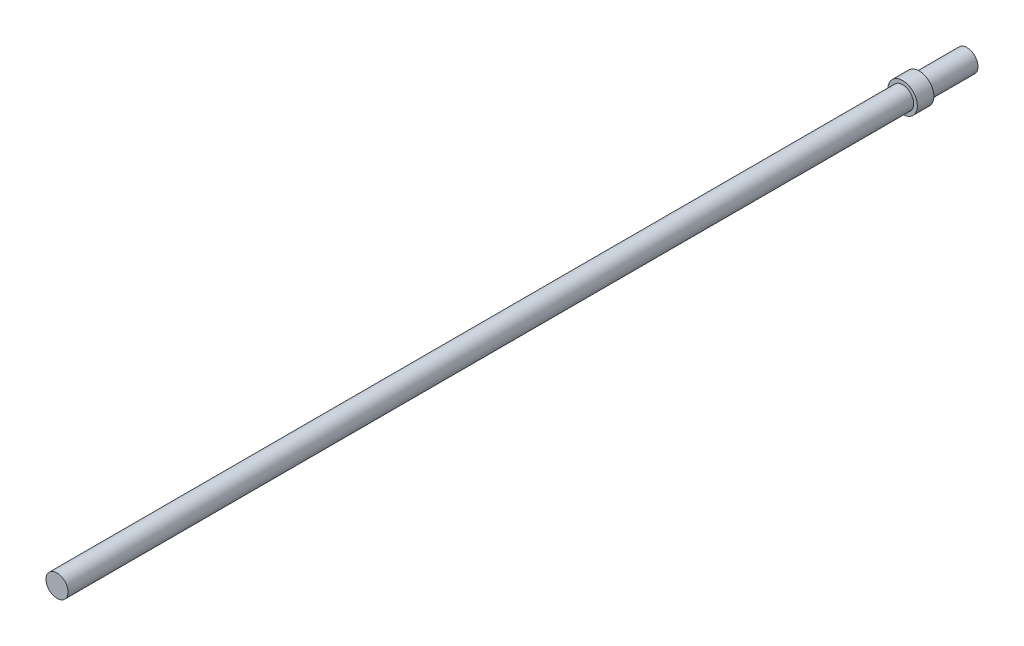
from build123d import *

# Parameters (mm, degrees)
SKETCH1_R           = 3
BOSS_EXTRUDE1_DEPTH = 230
SKETCH2_R           = 4
BOSS_EXTRUDE2_DEPTH = 4.5
BOSS_EXTRUDE3_START = -17.5
SKETCH3_R           = 3
BOSS_EXTRUDE3_DEPTH = 17.5


with BuildPart() as part:
    # Sketch1 → Boss-Extrude1 (new body)
    with BuildSketch(Plane.XY):
        Circle(SKETCH1_R)
    extrude(amount=BOSS_EXTRUDE1_DEPTH)

    # Sketch2 → Boss-Extrude2 (add)
    with BuildSketch(Plane.XY):
        Circle(SKETCH2_R)
    extrude(amount=-BOSS_EXTRUDE2_DEPTH)

    # Sketch3 → Boss-Extrude3 (add)
    with BuildSketch(Plane.XY.offset(BOSS_EXTRUDE3_START)):
        Circle(SKETCH3_R)
    extrude(amount=BOSS_EXTRUDE3_DEPTH)


solid = part.part
